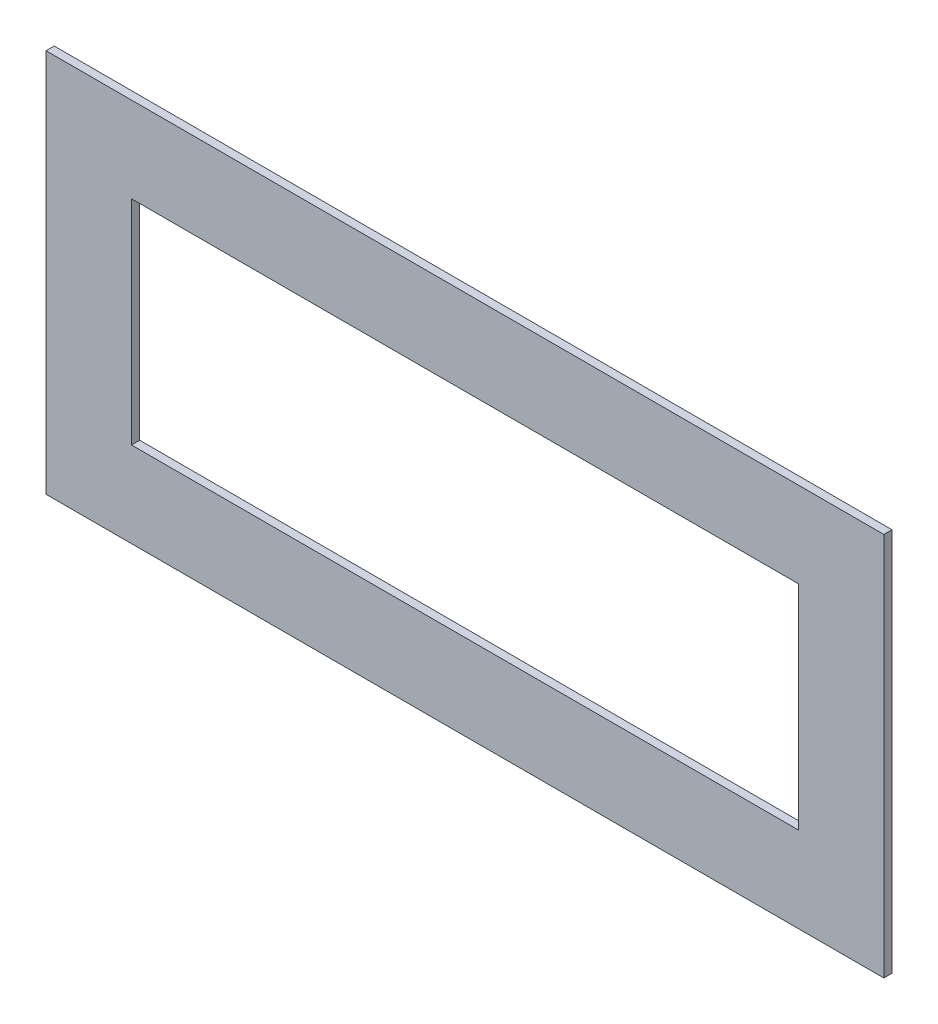
from build123d import *

# Parameters (mm, degrees)
SKETCH1_W           = 187.7314
SKETCH1_H           = 86.0806
SKETCH1_W_2         = 149.4282
SKETCH1_H_2         = 47.7774
BOSS_EXTRUDE1_DEPTH = 1.8288


with BuildPart() as part:
    # Sketch1 → Boss-Extrude1 (new body)
    with BuildSketch(Plane.XY):
        with Locations((27.471050993, -0.507875683)):
            Rectangle(SKETCH1_W, SKETCH1_H)
        with Locations((27.471050993, -0.507875683)):
            Rectangle(SKETCH1_W_2, SKETCH1_H_2, mode=Mode.SUBTRACT)
    extrude(amount=BOSS_EXTRUDE1_DEPTH)


solid = part.part
